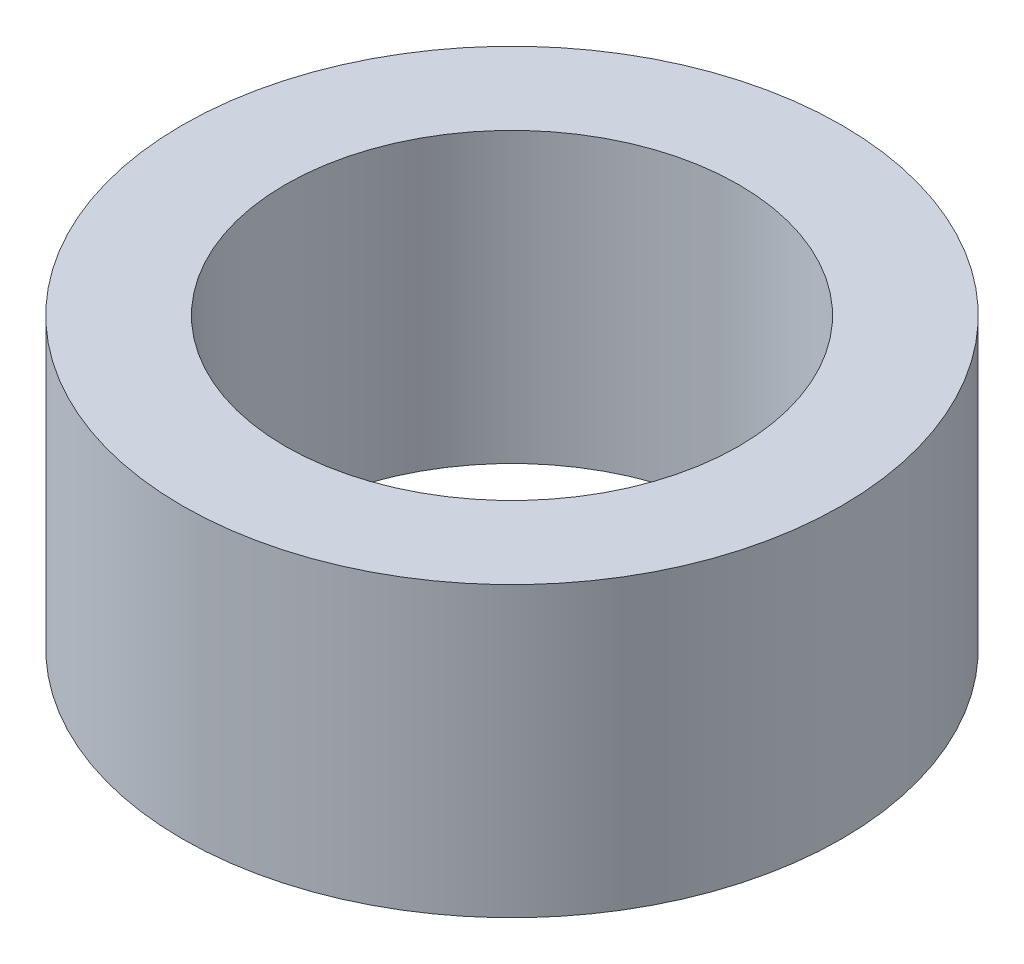
from build123d import *

# Parameters (mm, degrees)
SKETCH1_R           = 8
SKETCH1_R_2         = 5.5
BOSS_EXTRUDE1_DEPTH = 7


with BuildPart() as part:
    # Sketch1 → Boss-Extrude1 (new body)
    with BuildSketch(Plane(origin=(0, 0, 0), x_dir=(1, 0, 0), z_dir=(0, 1, 0))):
        with Locations(Location((0, 0, 0), (0, 0, 270))):
            Circle(SKETCH1_R)
        with Locations(Location((0, 0, 0), (0, 0, 270))):
            Circle(SKETCH1_R_2, mode=Mode.SUBTRACT)
    extrude(amount=BOSS_EXTRUDE1_DEPTH)


solid = part.part
